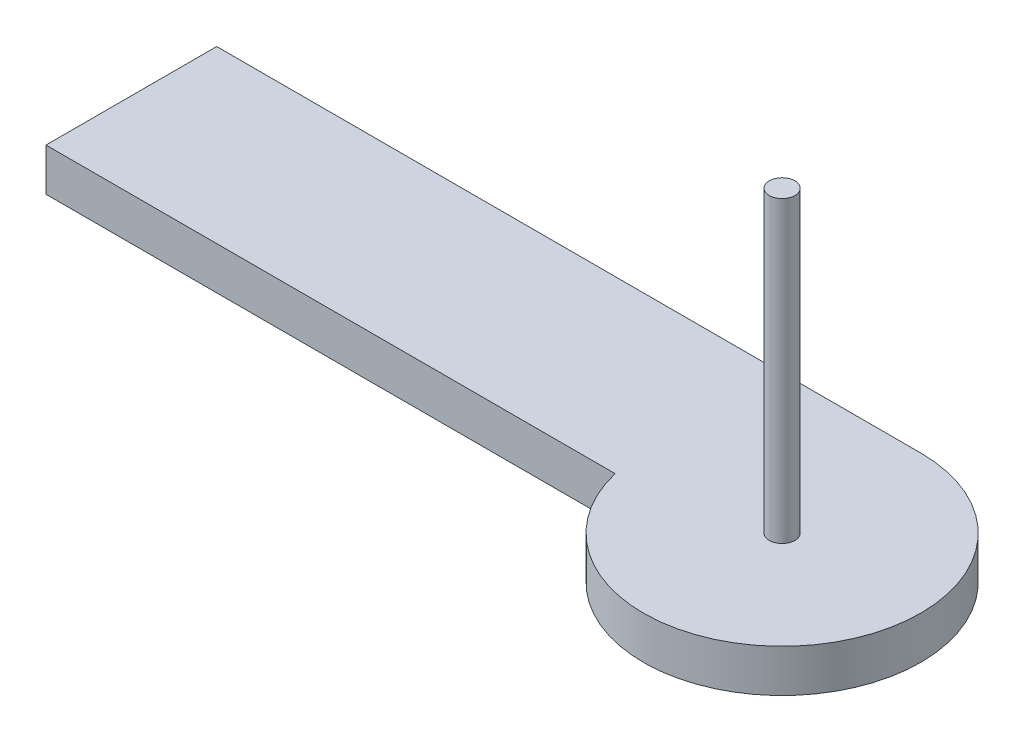
from build123d import *

# Parameters (mm, degrees)
SKETCH1_R           = 32.5
BOSS_EXTRUDE1_DEPTH = 10
SKETCH2_R           = 3
BOSS_EXTRUDE2_DEPTH = 70


with BuildPart() as part:
    # Sketch1 → Boss-Extrude1 (new body)
    with BuildSketch(Plane(origin=(0, 0, 0), x_dir=(1, 0, 0), z_dir=(0, 1, 0))):
        with BuildLine():
            ThreePointArc((-31.622776602, -7.5), (-25.495097568, 20.155644371), (0, 32.5))
            Line((0, 32.5), (-165, 32.5))
            Line((-165, 32.5), (-165, -7.5))
            Line((-165, -7.5), (-31.622776602, -7.5))
        make_face()
        Circle(SKETCH1_R)
    extrude(amount=BOSS_EXTRUDE1_DEPTH)

    # Sketch2 → Boss-Extrude2 (add)
    with BuildSketch(Plane(origin=(0, 10, 0), x_dir=(1, 0, 0), z_dir=(0, 1, 0))):
        with Locations(Location((0, 0, 0), (0, 0, 270))):
            Circle(SKETCH2_R)
    extrude(amount=BOSS_EXTRUDE2_DEPTH)


solid = part.part
